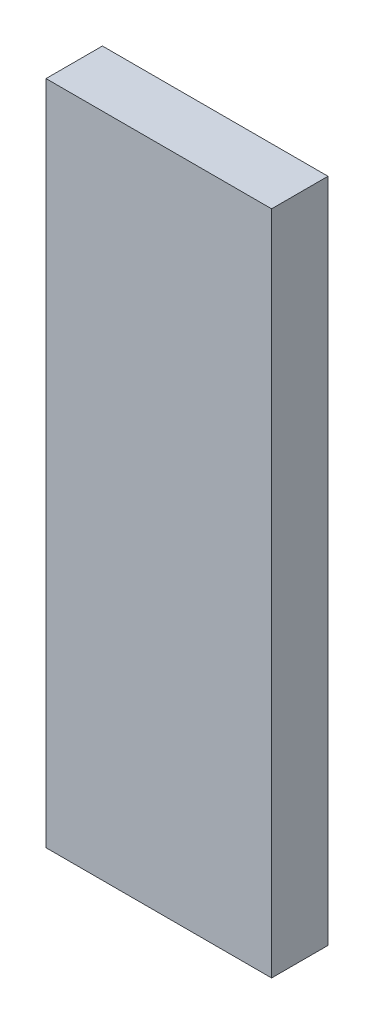
from build123d import *

# Parameters (mm, degrees)
SKETCH2_W           = 25.4
SKETCH2_H           = 74.999999924
BOSS_EXTRUDE1_DEPTH = 6.35


with BuildPart() as part:
    # Sketch2 → Boss-Extrude1 (new body)
    with BuildSketch(Plane.XY):
        with Locations((12.7, 37.499999962)):
            Rectangle(SKETCH2_W, SKETCH2_H)
    extrude(amount=BOSS_EXTRUDE1_DEPTH)


solid = part.part
